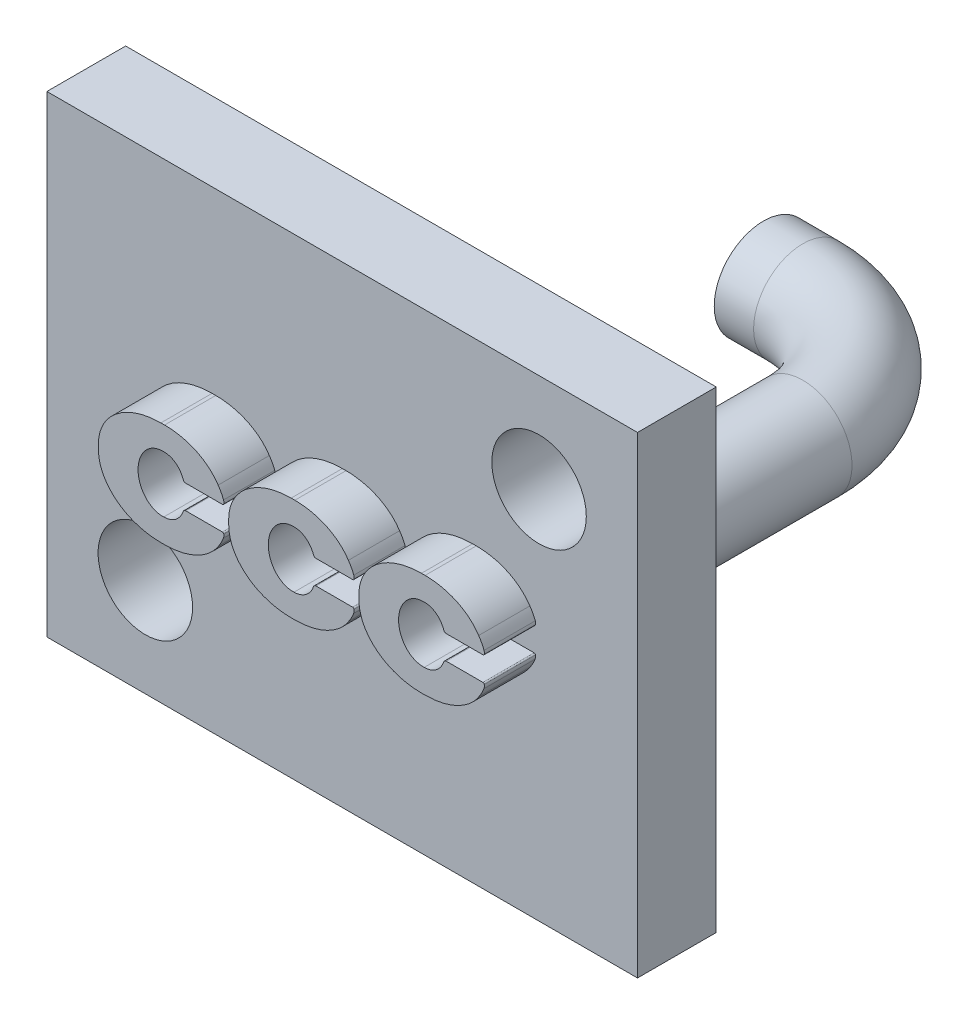
from build123d import *

# Parameters (mm, degrees)
SKETCH1_W           = 15
SKETCH1_H           = 12
BOSS_EXTRUDE1_DEPTH = 2
BOSS_EXTRUDE2_DEPTH = 2
SKETCH8_R           = 1.25
BOSS_EXTRUDE4_DEPTH = 4.5
SKETCH7_R           = 1.25
BOSS_EXTRUDE5_DEPTH = 4.5
SKETCH10_R          = 1.25
SKETCH11_R          = 1.2
CUT_EXTRUDE1_DEPTH  = 16.566390241
CUT_EXTRUDE2_START  = -0.7
CUT_EXTRUDE2_DEPTH  = 0.7


with BuildPart() as part:
    # Sketch1 → Boss-Extrude1 (new body)
    with BuildSketch(Plane.XY):
        Rectangle(SKETCH1_W, SKETCH1_H)
    extrude(amount=BOSS_EXTRUDE1_DEPTH)

    # Sketch2 → Boss-Extrude2 (add)
    with BuildSketch(Plane.XY.offset(2)):
        with BuildLine():
            Line((0.634224842, 0.446622561), (1.570059765, 0.446622561))
            ThreePointArc((1.570059765, 0.446622561), (1.588369985, 0.454710358), (1.599303813, 0.471477232))
            ThreePointArc((1.599303813, 0.471477232), (1.602490266, 0.515469012), (1.595115254, 0.558955096))
            ThreePointArc((1.595115254, 0.558955096), (1.534667405, 0.691940337), (1.457953143, 0.816254209))
            add(Edge.make_bspline(
                [(1.457953143, 0.816254209), (1.03965558, 1.457388582), (0.096854108, 1.457388582)],
                knots=[3.484341046, 3.484341046, 3.484341046, 4.522924348, 4.522924348, 4.522924348], degree=2, weights=[1, 0.868170926, 1]))
            Line((0.096854108, 1.457388582), (0.003233055, 1.457388597))
            add(Edge.make_bspline(
                [(0.003233055, 1.457388597), (-1.582423807, 1.457388597), (-1.582423807, 0.206233521)],
                knots=[4.81203319, 4.81203319, 4.81203319, 6.344970327, 6.344970327, 6.344970327], degree=2, weights=[1, 0.720364542, 1]))
            Line((-1.582423807, 0.206233521), (-1.5824238, 0.076103267))
            add(Edge.make_bspline(
                [(-1.5824238, 0.076103267), (-1.5824238, -1.175051809), (0.003233062, -1.175051809)],
                knots=[3.079807634, 3.079807634, 3.079807634, 4.612744771, 4.612744771, 4.612744771], degree=2, weights=[1, 0.720364542, 1]))
            Line((0.003233062, -1.175051809), (0.096854115, -1.175051845))
            add(Edge.make_bspline(
                [(0.096854115, -1.175051845), (1.039655587, -1.175051845), (1.457953149, -0.533917473)],
                knots=[4.901853612, 4.901853612, 4.901853612, 5.940436915, 5.940436915, 5.940436915], degree=2, weights=[1, 0.868170926, 1]))
            ThreePointArc((1.457953149, -0.533917473), (1.531703243, -0.414814638), (1.590367214, -0.287601825))
            ThreePointArc((1.590367214, -0.287601825), (1.601960202, -0.239278511), (1.600198093, -0.189615296))
            ThreePointArc((1.600198093, -0.189615296), (1.588193533, -0.168692307), (1.565533518, -0.160421594))
            Line((1.565533518, -0.160421594), (0.634224796, -0.160421594))
            ThreePointArc((0.634224796, -0.160421594), (0.596456966, -0.172422393), (0.572543427, -0.204022564))
            add(Edge.make_bspline(
                [(0.076051849, -0.574906117), (0.441159759, -0.575265322), (0.572543427, -0.204022564)],
                knots=[2.81356271, 2.81356271, 2.81356271, 3.879142891, 3.879142891, 3.879142891], degree=2, weights=[1, 0.86139323, 1]))
            add(Edge.make_bspline(
                [(0.016258692, 0.857730053), (-0.605831041, 0.826272418), (-0.575845172, 0.107814931), (-0.545859303, -0.610642557), (0.076051849, -0.574906117)],
                knots=[3.181025595, 3.181025595, 3.181025595, 4.754799698, 4.754799698, 6.328573801, 6.328573801, 6.328573801], degree=2, weights=[1, 0.706053195, 1, 0.706053195, 1]))
            add(Edge.make_bspline(
                [(0.572543422, 0.490223566), (0.426304596, 0.9034416), (0.016258692, 0.857730053)],
                knots=[2.404042441, 2.404042441, 2.404042441, 3.565685694, 3.565685694, 3.565685694], degree=2, weights=[1, 0.836012096, 1]))
            ThreePointArc((0.572543422, 0.490223566), (0.596456981, 0.45862337), (0.634224842, 0.446622561))
        make_face()
        with BuildLine():
            Line((-2.674079704, 0.446622561), (-1.73824478, 0.446622561))
            ThreePointArc((-1.73824478, 0.446622561), (-1.71993453, 0.454710345), (-1.709000682, 0.471477232))
            ThreePointArc((-1.709000682, 0.471477232), (-1.705814228, 0.515469012), (-1.713189241, 0.558955096))
            ThreePointArc((-1.713189241, 0.558955096), (-1.77363709, 0.691940337), (-1.850351352, 0.816254209))
            add(Edge.make_bspline(
                [(-1.850351352, 0.816254209), (-2.268648914, 1.457388582), (-3.211450386, 1.457388582)],
                knots=[0.342748392, 0.342748392, 0.342748392, 1.381331695, 1.381331695, 1.381331695], degree=2, weights=[1, 0.868170926, 1]))
            Line((-3.211450386, 1.457388582), (-3.305071439, 1.457388597))
            add(Edge.make_bspline(
                [(-3.305071439, 1.457388597), (-4.890728301, 1.457388597), (-4.890728301, 0.206233521)],
                knots=[1.670440536, 1.670440536, 1.670440536, 3.203377674, 3.203377674, 3.203377674], degree=2, weights=[1, 0.720364542, 1]))
            Line((-4.890728301, 0.206233521), (-4.890728345, 0.076103267))
            add(Edge.make_bspline(
                [(-4.890728345, 0.076103267), (-4.890728345, -1.175051809), (-3.305071484, -1.175051809)],
                knots=[3.079807634, 3.079807634, 3.079807634, 4.612744771, 4.612744771, 4.612744771], degree=2, weights=[1, 0.720364542, 1]))
            Line((-3.305071484, -1.175051809), (-3.211450431, -1.175051845))
            add(Edge.make_bspline(
                [(-3.211450431, -1.175051845), (-2.268648958, -1.175051845), (-1.850351396, -0.533917473)],
                knots=[4.901853612, 4.901853612, 4.901853612, 5.940436915, 5.940436915, 5.940436915], degree=2, weights=[1, 0.868170926, 1]))
            ThreePointArc((-1.850351396, -0.533917473), (-1.776601302, -0.414814638), (-1.717937331, -0.287601825))
            ThreePointArc((-1.717937331, -0.287601825), (-1.706344344, -0.239278511), (-1.708106452, -0.189615296))
            ThreePointArc((-1.708106452, -0.189615296), (-1.720111013, -0.168692307), (-1.742771027, -0.160421594))
            Line((-1.742771027, -0.160421594), (-2.674079749, -0.160421594))
            ThreePointArc((-2.674079749, -0.160421594), (-2.711847579, -0.172422393), (-2.735761118, -0.204022564))
            add(Edge.make_bspline(
                [(-3.232252697, -0.574906117), (-2.867144786, -0.575265322), (-2.735761118, -0.204022564)],
                knots=[2.81356271, 2.81356271, 2.81356271, 3.879142891, 3.879142891, 3.879142891], degree=2, weights=[1, 0.86139323, 1]))
            add(Edge.make_bspline(
                [(-3.292045853, 0.857730053), (-3.914135587, 0.826272419), (-3.884149717, 0.107814931), (-3.854163848, -0.610642557), (-3.232252697, -0.574906117)],
                knots=[3.181025595, 3.181025595, 3.181025595, 4.754799698, 4.754799698, 6.328573801, 6.328573801, 6.328573801], degree=2, weights=[1, 0.706053195, 1, 0.706053195, 1]))
            add(Edge.make_bspline(
                [(-2.735761124, 0.490223566), (-2.88199995, 0.9034416), (-3.292045853, 0.857730053)],
                knots=[2.40404244, 2.40404244, 2.40404244, 3.565685694, 3.565685694, 3.565685694], degree=2, weights=[1, 0.836012096, 1]))
            ThreePointArc((-2.735761124, 0.490223566), (-2.711847564, 0.45862337), (-2.674079704, 0.446622561))
        make_face()
        with BuildLine():
            Line((3.942529388, 0.446622561), (4.878364311, 0.446622561))
            ThreePointArc((4.878364311, 0.446622561), (4.896674531, 0.454710358), (4.907608359, 0.471477232))
            ThreePointArc((4.907608359, 0.471477232), (4.910794812, 0.515469012), (4.9034198, 0.558955096))
            ThreePointArc((4.9034198, 0.558955096), (4.842971951, 0.691940337), (4.766257689, 0.816254209))
            add(Edge.make_bspline(
                [(4.766257689, 0.816254209), (4.347960126, 1.457388582), (3.405158654, 1.457388582)],
                knots=[0.342748392, 0.342748392, 0.342748392, 1.381331695, 1.381331695, 1.381331695], degree=2, weights=[1, 0.868170926, 1]))
            Line((3.405158654, 1.457388582), (3.311537601, 1.457388597))
            add(Edge.make_bspline(
                [(3.311537601, 1.457388597), (1.725880739, 1.457388597), (1.725880739, 0.206233521)],
                knots=[4.81203319, 4.81203319, 4.81203319, 6.344970327, 6.344970327, 6.344970327], degree=2, weights=[1, 0.720364542, 1]))
            Line((1.725880739, 0.206233521), (1.725880746, 0.076103267))
            add(Edge.make_bspline(
                [(1.725880746, 0.076103267), (1.725880746, -1.175051809), (3.311537608, -1.175051809)],
                knots=[3.079807634, 3.079807634, 3.079807634, 4.612744771, 4.612744771, 4.612744771], degree=2, weights=[1, 0.720364542, 1]))
            Line((3.311537608, -1.175051809), (3.405158661, -1.175051845))
            add(Edge.make_bspline(
                [(3.405158661, -1.175051845), (4.347960133, -1.175051845), (4.766257695, -0.533917473)],
                knots=[1.760260959, 1.760260959, 1.760260959, 2.798844261, 2.798844261, 2.798844261], degree=2, weights=[1, 0.868170926, 1]))
            ThreePointArc((4.766257695, -0.533917473), (4.840007789, -0.414814638), (4.89867176, -0.287601825))
            ThreePointArc((4.89867176, -0.287601825), (4.910264748, -0.239278511), (4.908502639, -0.189615296))
            ThreePointArc((4.908502639, -0.189615296), (4.896498079, -0.168692307), (4.873838064, -0.160421594))
            Line((4.873838064, -0.160421594), (3.942529342, -0.160421594))
            ThreePointArc((3.942529342, -0.160421594), (3.904761512, -0.172422393), (3.880847973, -0.204022564))
            add(Edge.make_bspline(
                [(3.384356395, -0.574906117), (3.749464305, -0.575265322), (3.880847973, -0.204022564)],
                knots=[2.81356271, 2.81356271, 2.81356271, 3.879142891, 3.879142891, 3.879142891], degree=2, weights=[1, 0.86139323, 1]))
            add(Edge.make_bspline(
                [(3.324563238, 0.857730053), (2.702473505, 0.826272418), (2.732459374, 0.107814931), (2.762445243, -0.610642557), (3.384356395, -0.574906117)],
                knots=[3.181025595, 3.181025595, 3.181025595, 4.754799698, 4.754799698, 6.328573801, 6.328573801, 6.328573801], degree=2, weights=[1, 0.706053195, 1, 0.706053195, 1]))
            add(Edge.make_bspline(
                [(3.880847968, 0.490223566), (3.734609142, 0.9034416), (3.324563238, 0.857730053)],
                knots=[5.545635094, 5.545635094, 5.545635094, 6.707278348, 6.707278348, 6.707278348], degree=2, weights=[1, 0.836012096, 1]))
            ThreePointArc((3.880847968, 0.490223566), (3.904761527, 0.45862337), (3.942529388, 0.446622561))
        make_face()
    extrude(amount=BOSS_EXTRUDE2_DEPTH)

    # Sketch8 → Boss-Extrude4 (add)
    with BuildSketch(Plane(origin=(0, 0, 0), x_dir=(-1, 0, 0), z_dir=(0, 0, -1))):
        with Locations(Location((0.8, 0, 0), (0, 0, 180))):
            Circle(SKETCH8_R)
    extrude(amount=BOSS_EXTRUDE4_DEPTH)

    # Sketch7 → Boss-Extrude5 (add)
    with BuildSketch(Plane(origin=(0, 0, 0), x_dir=(-1, 0, 0), z_dir=(0, 0, -1))):
        with Locations(Location((5.5, 0, 0), (0, 0, 180))):
            Circle(SKETCH7_R)
    extrude(amount=BOSS_EXTRUDE5_DEPTH)

    # Sweep4: sweep along a path in Sketch9
    with BuildLine(Plane(origin=(0, 0, 0), x_dir=(1, 0, 0), z_dir=(0, 1, 0))) as sweep4_path:
        Line((3.698731885, 0), (3.698731885, 6))
        ThreePointArc((3.698731885, 6), (2.820052228, 8.121320344), (0.698731885, 9))
        Line((0.698731885, 9), (-0.301268115, 9))
    # Sketch10 → Sweep4 (sweep)
    with BuildSketch(Plane(origin=(0, 0, 0), x_dir=(-1, 0, 0), z_dir=(0, 0, -1))):
        with Locations((-3.698731885, 0)):
            Circle(SKETCH10_R)
    sweep(path=sweep4_path.line)

    # Sketch11 → Cut-Extrude1 (cut, through all)
    with BuildSketch(Plane.XY.offset(2)):
        with Locations((-5, -3.5)):
            Circle(SKETCH11_R)
        with Locations((5, 3.5)):
            Circle(SKETCH11_R)
    extrude(amount=-CUT_EXTRUDE1_DEPTH, mode=Mode.SUBTRACT)

    # Sketch13 → Cut-Extrude2 (cut)
    with BuildSketch(Plane.XY.offset(4).offset(CUT_EXTRUDE2_START)):
        with BuildLine():
            Line((-2.674079704, 0.446622561), (-1.73824478, 0.446622561))
            ThreePointArc((-1.73824478, 0.446622561), (-1.71993453, 0.454710345), (-1.709000682, 0.471477232))
            ThreePointArc((-1.709000682, 0.471477232), (-1.705814228, 0.515469012), (-1.713189241, 0.558955096))
            ThreePointArc((-1.713189241, 0.558955096), (-1.77363709, 0.691940337), (-1.850351352, 0.816254209))
            add(Edge.make_bspline(
                [(-1.850351352, 0.816254209), (-2.268648914, 1.457388582), (-3.211450386, 1.457388582)],
                knots=[3.484341046, 3.484341046, 3.484341046, 4.522924348, 4.522924348, 4.522924348], degree=2, weights=[1, 0.868170926, 1]))
            Line((-3.211450386, 1.457388582), (-3.305071439, 1.457388597))
            add(Edge.make_bspline(
                [(-3.305071439, 1.457388597), (-4.890728301, 1.457388597), (-4.890728301, 0.206233521)],
                knots=[4.81203319, 4.81203319, 4.81203319, 6.344970327, 6.344970327, 6.344970327], degree=2, weights=[1, 0.720364542, 1]))
            Line((-4.890728301, 0.206233521), (-4.890728345, 0.076103267))
            add(Edge.make_bspline(
                [(-4.890728345, 0.076103267), (-4.890728345, -1.175051809), (-3.305071484, -1.175051809)],
                knots=[3.079807634, 3.079807634, 3.079807634, 4.612744771, 4.612744771, 4.612744771], degree=2, weights=[1, 0.720364542, 1]))
            Line((-3.305071484, -1.175051809), (-3.211450431, -1.175051845))
            add(Edge.make_bspline(
                [(-3.211450431, -1.175051845), (-2.268648958, -1.175051845), (-1.850351396, -0.533917473)],
                knots=[1.760260959, 1.760260959, 1.760260959, 2.798844261, 2.798844261, 2.798844261], degree=2, weights=[1, 0.868170926, 1]))
            ThreePointArc((-1.850351396, -0.533917473), (-1.776601302, -0.414814638), (-1.717937331, -0.287601825))
            ThreePointArc((-1.717937331, -0.287601825), (-1.706344344, -0.239278511), (-1.708106452, -0.189615296))
            ThreePointArc((-1.708106452, -0.189615296), (-1.720111013, -0.168692307), (-1.742771027, -0.160421594))
            Line((-1.742771027, -0.160421594), (-2.674079749, -0.160421594))
            ThreePointArc((-2.674079749, -0.160421594), (-2.711847579, -0.172422393), (-2.735761118, -0.204022564))
            add(Edge.make_bspline(
                [(-3.232252697, -0.574906117), (-2.867144786, -0.575265322), (-2.735761118, -0.204022564)],
                knots=[5.955155363, 5.955155363, 5.955155363, 7.020735545, 7.020735545, 7.020735545], degree=2, weights=[1, 0.86139323, 1]))
            add(Edge.make_bspline(
                [(-3.292045853, 0.857730053), (-3.914135587, 0.826272419), (-3.884149717, 0.107814931), (-3.854163848, -0.610642557), (-3.232252697, -0.574906117)],
                knots=[3.181025595, 3.181025595, 3.181025595, 4.754799698, 4.754799698, 6.328573801, 6.328573801, 6.328573801], degree=2, weights=[1, 0.706053195, 1, 0.706053195, 1]))
            add(Edge.make_bspline(
                [(-2.735761124, 0.490223566), (-2.88199995, 0.9034416), (-3.292045853, 0.857730053)],
                knots=[2.40404244, 2.40404244, 2.40404244, 3.565685694, 3.565685694, 3.565685694], degree=2, weights=[1, 0.836012096, 1]))
            ThreePointArc((-2.735761124, 0.490223566), (-2.711847564, 0.45862337), (-2.674079704, 0.446622561))
        make_face()
        with BuildLine():
            Line((0.634224842, 0.446622561), (1.570059765, 0.446622561))
            ThreePointArc((1.570059765, 0.446622561), (1.588369985, 0.454710358), (1.599303813, 0.471477232))
            ThreePointArc((1.599303813, 0.471477232), (1.602490266, 0.515469012), (1.595115254, 0.558955096))
            ThreePointArc((1.595115254, 0.558955096), (1.534667405, 0.691940337), (1.457953143, 0.816254209))
            add(Edge.make_bspline(
                [(1.457953143, 0.816254209), (1.03965558, 1.457388582), (0.096854108, 1.457388582)],
                knots=[0.342748392, 0.342748392, 0.342748392, 1.381331695, 1.381331695, 1.381331695], degree=2, weights=[1, 0.868170926, 1]))
            Line((0.096854108, 1.457388582), (0.003233055, 1.457388597))
            add(Edge.make_bspline(
                [(0.003233055, 1.457388597), (-1.582423807, 1.457388597), (-1.582423807, 0.206233521)],
                knots=[4.81203319, 4.81203319, 4.81203319, 6.344970327, 6.344970327, 6.344970327], degree=2, weights=[1, 0.720364542, 1]))
            Line((-1.582423807, 0.206233521), (-1.5824238, 0.076103267))
            add(Edge.make_bspline(
                [(-1.5824238, 0.076103267), (-1.5824238, -1.175051809), (0.003233062, -1.175051809)],
                knots=[3.079807634, 3.079807634, 3.079807634, 4.612744771, 4.612744771, 4.612744771], degree=2, weights=[1, 0.720364542, 1]))
            Line((0.003233062, -1.175051809), (0.096854115, -1.175051845))
            add(Edge.make_bspline(
                [(0.096854115, -1.175051845), (1.039655587, -1.175051845), (1.457953149, -0.533917473)],
                knots=[1.760260959, 1.760260959, 1.760260959, 2.798844261, 2.798844261, 2.798844261], degree=2, weights=[1, 0.868170926, 1]))
            ThreePointArc((1.457953149, -0.533917473), (1.531703243, -0.414814638), (1.590367214, -0.287601825))
            ThreePointArc((1.590367214, -0.287601825), (1.601960202, -0.239278511), (1.600198093, -0.189615296))
            ThreePointArc((1.600198093, -0.189615296), (1.588193533, -0.168692307), (1.565533518, -0.160421594))
            Line((1.565533518, -0.160421594), (0.634224796, -0.160421594))
            ThreePointArc((0.634224796, -0.160421594), (0.596456966, -0.172422393), (0.572543427, -0.204022564))
            add(Edge.make_bspline(
                [(0.076051849, -0.574906117), (0.441159759, -0.575265322), (0.572543427, -0.204022564)],
                knots=[5.955155363, 5.955155363, 5.955155363, 7.020735545, 7.020735545, 7.020735545], degree=2, weights=[1, 0.86139323, 1]))
            add(Edge.make_bspline(
                [(0.016258692, 0.857730053), (-0.605831041, 0.826272418), (-0.575845172, 0.107814931), (-0.545859303, -0.610642557), (0.076051849, -0.574906117)],
                knots=[3.181025595, 3.181025595, 3.181025595, 4.754799698, 4.754799698, 6.328573801, 6.328573801, 6.328573801], degree=2, weights=[1, 0.706053195, 1, 0.706053195, 1]))
            add(Edge.make_bspline(
                [(0.572543422, 0.490223566), (0.426304596, 0.9034416), (0.016258692, 0.857730053)],
                knots=[2.404042441, 2.404042441, 2.404042441, 3.565685694, 3.565685694, 3.565685694], degree=2, weights=[1, 0.836012096, 1]))
            ThreePointArc((0.572543422, 0.490223566), (0.596456981, 0.45862337), (0.634224842, 0.446622561))
        make_face()
        with BuildLine():
            Line((3.942529388, 0.446622561), (4.878364311, 0.446622561))
            ThreePointArc((4.878364311, 0.446622561), (4.896674531, 0.454710358), (4.907608359, 0.471477232))
            ThreePointArc((4.907608359, 0.471477232), (4.910794812, 0.515469012), (4.9034198, 0.558955096))
            ThreePointArc((4.9034198, 0.558955096), (4.842971951, 0.691940337), (4.766257689, 0.816254209))
            add(Edge.make_bspline(
                [(4.766257689, 0.816254209), (4.347960126, 1.457388582), (3.405158654, 1.457388582)],
                knots=[0.342748392, 0.342748392, 0.342748392, 1.381331695, 1.381331695, 1.381331695], degree=2, weights=[1, 0.868170926, 1]))
            Line((3.405158654, 1.457388582), (3.311537601, 1.457388597))
            add(Edge.make_bspline(
                [(3.311537601, 1.457388597), (1.725880739, 1.457388597), (1.725880739, 0.206233521)],
                knots=[4.81203319, 4.81203319, 4.81203319, 6.344970327, 6.344970327, 6.344970327], degree=2, weights=[1, 0.720364542, 1]))
            Line((1.725880739, 0.206233521), (1.725880746, 0.076103267))
            add(Edge.make_bspline(
                [(1.725880746, 0.076103267), (1.725880746, -1.175051809), (3.311537608, -1.175051809)],
                knots=[3.079807634, 3.079807634, 3.079807634, 4.612744771, 4.612744771, 4.612744771], degree=2, weights=[1, 0.720364542, 1]))
            Line((3.311537608, -1.175051809), (3.405158661, -1.175051845))
            add(Edge.make_bspline(
                [(3.405158661, -1.175051845), (4.347960133, -1.175051845), (4.766257695, -0.533917473)],
                knots=[1.760260959, 1.760260959, 1.760260959, 2.798844261, 2.798844261, 2.798844261], degree=2, weights=[1, 0.868170926, 1]))
            ThreePointArc((4.766257695, -0.533917473), (4.840007789, -0.414814638), (4.89867176, -0.287601825))
            ThreePointArc((4.89867176, -0.287601825), (4.910264748, -0.239278511), (4.908502639, -0.189615296))
            ThreePointArc((4.908502639, -0.189615296), (4.896498079, -0.168692307), (4.873838064, -0.160421594))
            Line((4.873838064, -0.160421594), (3.942529342, -0.160421594))
            ThreePointArc((3.942529342, -0.160421594), (3.904761512, -0.172422393), (3.880847973, -0.204022564))
            add(Edge.make_bspline(
                [(3.384356395, -0.574906117), (3.749464305, -0.575265322), (3.880847973, -0.204022564)],
                knots=[5.955155363, 5.955155363, 5.955155363, 7.020735545, 7.020735545, 7.020735545], degree=2, weights=[1, 0.86139323, 1]))
            add(Edge.make_bspline(
                [(3.324563238, 0.857730053), (2.702473505, 0.826272418), (2.732459374, 0.107814931), (2.762445243, -0.610642557), (3.384356395, -0.574906117)],
                knots=[3.181025595, 3.181025595, 3.181025595, 4.754799698, 4.754799698, 6.328573801, 6.328573801, 6.328573801], degree=2, weights=[1, 0.706053195, 1, 0.706053195, 1]))
            add(Edge.make_bspline(
                [(3.880847968, 0.490223566), (3.734609142, 0.9034416), (3.324563238, 0.857730053)],
                knots=[2.404042441, 2.404042441, 2.404042441, 3.565685694, 3.565685694, 3.565685694], degree=2, weights=[1, 0.836012096, 1]))
            ThreePointArc((3.880847968, 0.490223566), (3.904761527, 0.45862337), (3.942529388, 0.446622561))
        make_face()
    extrude(amount=CUT_EXTRUDE2_DEPTH, mode=Mode.SUBTRACT)


solid = part.part
